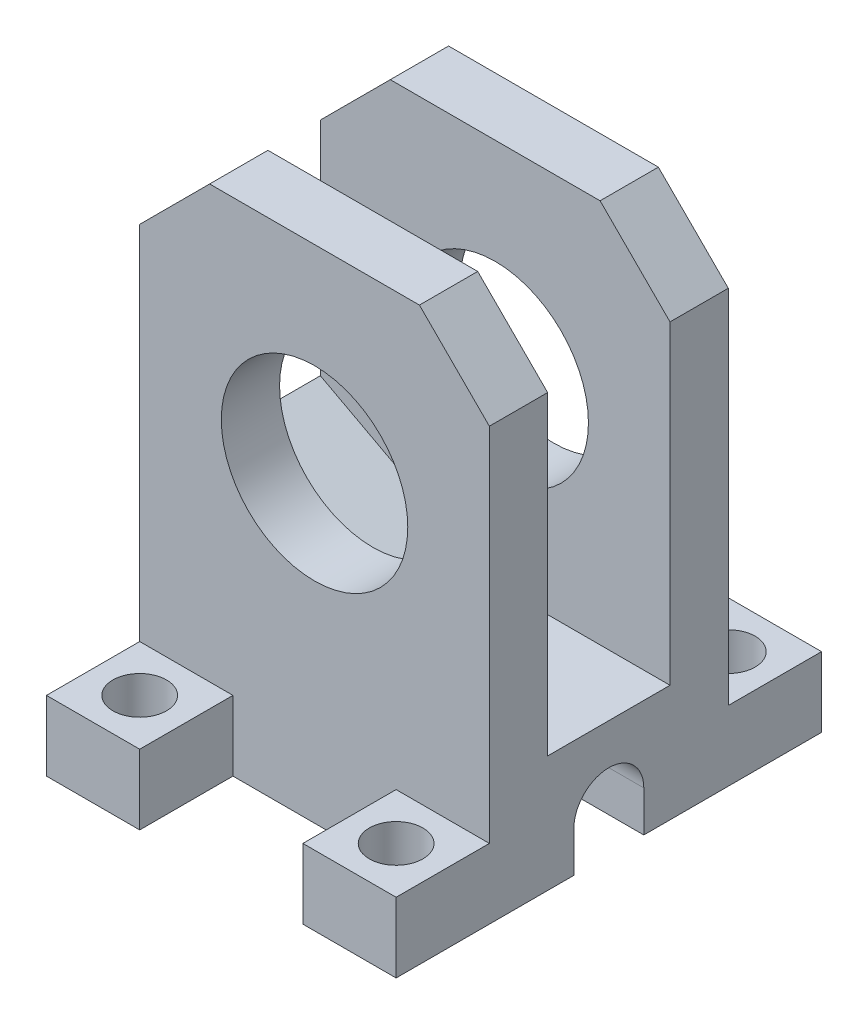
from build123d import *

# Parameters (mm, degrees)
ESQUISSE1_R             = 8
BOSS_EXTRU_1_DEPTH      = 5
ESQUISSE2_W             = 30
ESQUISSE2_H             = 12
BOSS_EXTRU_2_DEPTH      = 10.5
ESQUISSE4_W             = 30
ESQUISSE4_H             = 5
BOSS_EXTRU_3_DEPTH      = 45
ENL_V_START             = -10
ESQUISSE6_R             = 8
ENL_V_MAT_EXTRU_3_DEPTH = 10
ESQUISSE8_W             = 8
ESQUISSE8_H             = 8
ESQUISSE8_R             = 2.3
BOSS_EXTRU_4_DEPTH      = 8
ENL_V_MAT_EXTRU_4_DEPTH = 2
ENL_V_MAT_EXTRU_5_DEPTH = 50
ENL_V_MAT_EXTRU_6_DEPTH = 50
BOSS_EXTRU_5_DEPTH      = 10.5


with BuildPart() as part:
    # Esquisse1 → Boss.-Extru.1 (new body)
    with BuildSketch(Plane.XY):
        Polygon((0, 0), (15, 0), (15, 45), (-15, 45), (-15, 0), align=None)
        with Locations((0, 28)):
            Circle(ESQUISSE1_R, mode=Mode.SUBTRACT)
    extrude(amount=-BOSS_EXTRU_1_DEPTH)

    # Esquisse2 → Boss.-Extru.2 (add)
    with BuildSketch(Plane(origin=(0, 0, -5), x_dir=(-1, 0, 0), z_dir=(0, 0, -1))):
        with Locations((0, 6)):
            Rectangle(ESQUISSE2_W, ESQUISSE2_H)
    extrude(amount=BOSS_EXTRU_2_DEPTH)

    # Esquisse4 → Boss.-Extru.3 (add)
    with BuildSketch(Plane.XZ):
        with Locations((0, -18)):
            Rectangle(ESQUISSE4_W, ESQUISSE4_H)
    extrude(amount=-BOSS_EXTRU_3_DEPTH)

    # Esquisse6 → Enlèv. mat.-Extru.3 (cut)
    with BuildSketch(Plane(origin=(0, 0, -20.5), x_dir=(-1, 0, 0), z_dir=(0, 0, -1)).offset(ENL_V_START)):
        with Locations(Location((0, 28, 0), (0, 0, 180))):
            Circle(ESQUISSE6_R)
    extrude(amount=ENL_V_MAT_EXTRU_3_DEPTH, mode=Mode.SUBTRACT)

    # Esquisse8 → Boss.-Extru.4 (add)
    # profile 1 of 4: a face of its own
    with BuildSketch(Plane.XZ):
        with Locations((-11, 4)):
            Rectangle(ESQUISSE8_W, ESQUISSE8_H)
        with Locations(Location((-11, 4, 0), (0, 0, 270))):
            Circle(ESQUISSE8_R, mode=Mode.SUBTRACT)
    # profile 2 of 4: a face of its own
    with BuildSketch(Plane.XZ):
        with Locations((11, 4)):
            Rectangle(ESQUISSE8_W, ESQUISSE8_H)
        with Locations(Location((11, 4, 0), (0, 0, 270))):
            Circle(ESQUISSE8_R, mode=Mode.SUBTRACT)
    # profile 3 of 4: a face of its own
    with BuildSketch(Plane.XZ):
        with Locations((-11, -24.5)):
            Rectangle(ESQUISSE8_W, ESQUISSE8_H)
        with Locations(Location((-11, -24.5, 0), (0, 0, 270))):
            Circle(ESQUISSE8_R, mode=Mode.SUBTRACT)
    # profile 4 of 4: a face of its own
    with BuildSketch(Plane.XZ):
        with Locations((11, -24.5)):
            Rectangle(ESQUISSE8_W, ESQUISSE8_H)
        with Locations(Location((11, -24.5, 0), (0, 0, 270))):
            Circle(ESQUISSE8_R, mode=Mode.SUBTRACT)
    extrude(amount=-BOSS_EXTRU_4_DEPTH)

    # Esquisse9 → Enlèv. mat.-Extru.4 (cut)
    with BuildSketch(Plane.XZ):
        Polygon((-15, 8), (-15, -28.5), (-7, -28.5), (-7, -20.5), (7, -20.5), (7, -28.5), (15, -28.5), (15, 8), (7, 8), (7, 0), (-7, 0), (-7, 8), align=None)
    extrude(amount=-ENL_V_MAT_EXTRU_4_DEPTH, mode=Mode.SUBTRACT)

    # Esquisse10 → Enlèv. mat.-Extru.5 (cut)
    with BuildSketch(Plane.ZY.offset(15)):
        with BuildLine():
            Line((-13.25, 2), (-7.25, 2))
            Line((-7.25, 2), (-7.25, 5.5))
            ThreePointArc((-7.25, 5.5), (-10.25, 8.5), (-13.25, 5.5))
            Line((-13.25, 5.5), (-13.25, 2))
        make_face()
    extrude(amount=-ENL_V_MAT_EXTRU_5_DEPTH, mode=Mode.SUBTRACT)

    # Esquisse11 → Enlèv. mat.-Extru.6 (cut)
    with BuildSketch(Plane.XY):
        Polygon((-9, 45), (-15, 45), (-15, 39), align=None)
        Polygon((15, 45), (9, 45), (15, 39), align=None)
    extrude(amount=-ENL_V_MAT_EXTRU_6_DEPTH, mode=Mode.SUBTRACT)

    # Esquisse12 → Boss.-Extru.5 (add)
    with BuildSketch(Plane(origin=(0, 0, -5), x_dir=(-1, 0, 0), z_dir=(0, 0, -1))):
        Polygon((0, 12), (15, 12), (15, 20), align=None)
    extrude(amount=BOSS_EXTRU_5_DEPTH)


solid = part.part
